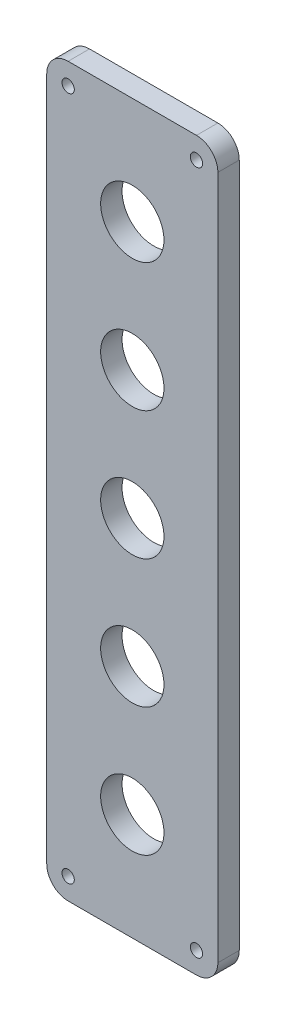
from build123d import *

# Parameters (mm, degrees)
SKETCH1_W             = 50.8
SKETCH1_H             = 215.9
BOSS_EXTRUDE1_DEPTH   = 6.35
SKETCH2_R             = 9.398
CUT_EXTRUDE1_DEPTH    = 6.35
LPATTERN1_COUNT       = 3
LPATTERN1_PITCH       = 38.1
LPATTERN1_COL_COUNT   = 3
LPATTERN1_COL_PITCH   = 38.1
F_6_CLEARANCE_HOLE1_D = 3.6576
FILLET1_R             = 6.35


with BuildPart() as part:
    # Sketch1 → Boss-Extrude1 (new body)
    with BuildSketch(Plane.XY):
        Rectangle(SKETCH1_W, SKETCH1_H)
    extrude(amount=BOSS_EXTRUDE1_DEPTH)

    # Sketch2 → Cut-Extrude1 (cut)
    with BuildSketch(Plane.XY.offset(6.35)):
        Circle(SKETCH2_R)
    cut_extrude1 = extrude(amount=-CUT_EXTRUDE1_DEPTH, mode=Mode.SUBTRACT)

    # LPattern1: Cut-Extrude1 ×3
    with Locations(*[(0, -i * LPATTERN1_PITCH, 0) for i in range(1, LPATTERN1_COUNT)]):
        add(cut_extrude1, mode=Mode.SUBTRACT)

    # LPattern1 col: Cut-Extrude1 ×3
    with Locations(*[(0, i * LPATTERN1_COL_PITCH, 0) for i in range(1, LPATTERN1_COL_COUNT)]):
        add(cut_extrude1, mode=Mode.SUBTRACT)

    # #6 Clearance Hole1 (through all)
    with Locations(Plane.XY.offset(6.35)):
        with Locations((19.05, -101.6), (0, 0), (19.05, 101.6), (-19.05, -101.6), (-19.05, 101.6)):
            Hole(F_6_CLEARANCE_HOLE1_D / 2)

    # Fillet1
    fillet1_edges = [part.edges().sort_by_distance(p)[0] for p in [
        (25.4, -107.95, 3.175),
        (-25.4, -107.95, 3.175),
        (-25.4, 107.95, 3.175),
        (25.4, 107.95, 3.175),
    ]]
    fillet(fillet1_edges, radius=FILLET1_R)


solid = part.part
